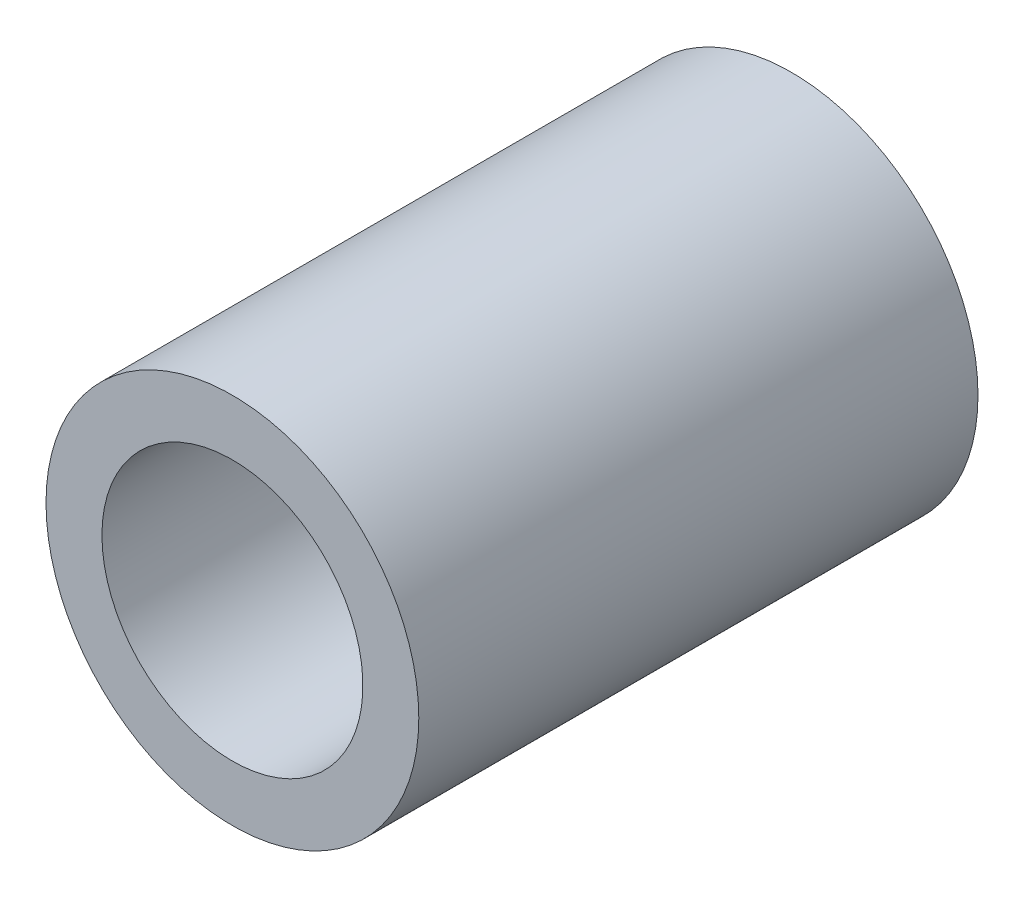
from build123d import *

# Parameters (mm, degrees)
SKETCH1_R           = 1.4
BOSS_EXTRUDE1_DEPTH = 6
SKETCH2_R           = 2
BOSS_EXTRUDE2_DEPTH = 6
SKETCH3_R           = 1.4
CUT_EXTRUDE1_DEPTH  = 13.328828006


with BuildPart() as part:
    # Sketch1 → Boss-Extrude1 (new body)
    with BuildSketch(Plane.XY):
        Circle(SKETCH1_R)
    extrude(amount=BOSS_EXTRUDE1_DEPTH)

    # Sketch2 → Boss-Extrude2 (add)
    with BuildSketch(Plane(origin=(0, 0, 0), x_dir=(-1, 0, 0), z_dir=(0, 0, -1))):
        Circle(SKETCH2_R)
    extrude(amount=BOSS_EXTRUDE2_DEPTH)

    # Sketch3 → Cut-Extrude1 (cut, through all)
    with BuildSketch(Plane(origin=(0, 0, -6), x_dir=(-1, 0, 0), z_dir=(0, 0, -1))):
        Circle(SKETCH3_R)
    extrude(amount=-CUT_EXTRUDE1_DEPTH, mode=Mode.SUBTRACT)


solid = part.part
